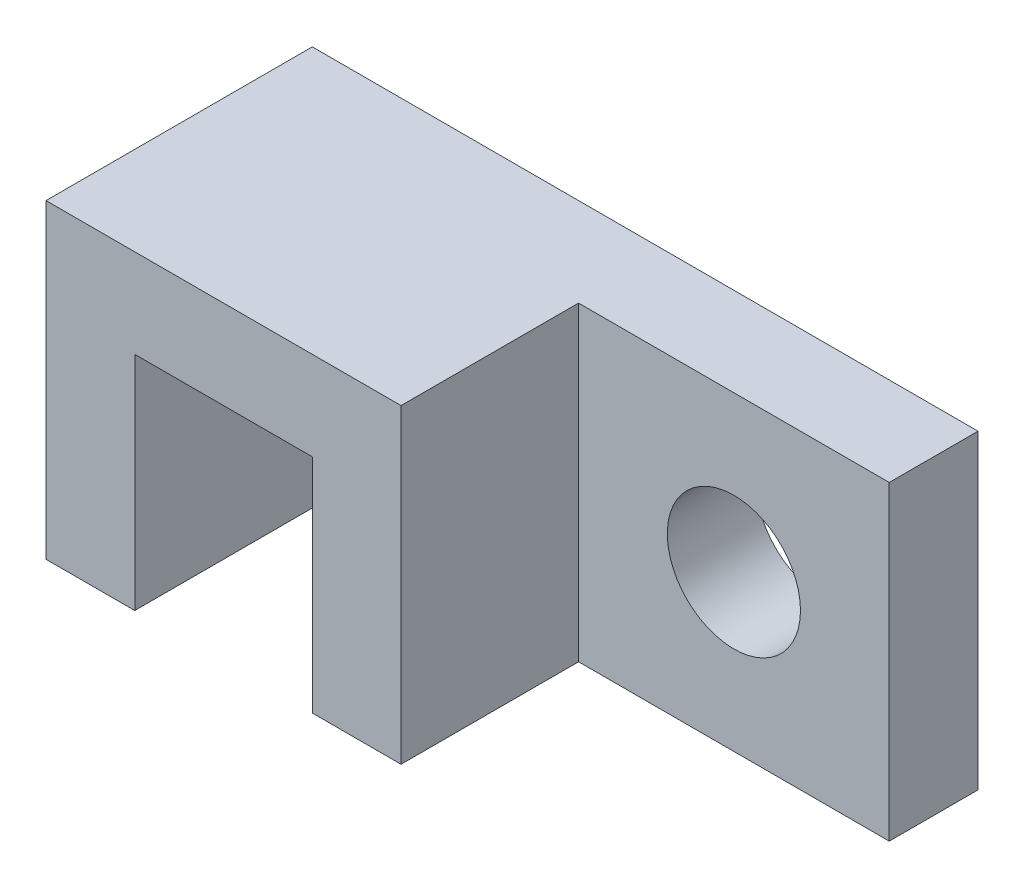
from build123d import *

# Parameters (mm, degrees)
BOSS_EXTRUDE1_DEPTH = 30
SKETCH1_3_W         = 35
SKETCH1_3_H         = 35
SKETCH1_3_R         = 7.5
BOSS_EXTRUDE2_DEPTH = 10


with BuildPart() as part:
    # Sketch1 → Boss-Extrude1 (new body)
    with BuildSketch(Plane.XY):
        Polygon((10, 0), (10, 25), (30, 25), (30, 0), (40, 0), (40, 35), (0, 35), (0, 0), align=None)
    extrude(amount=BOSS_EXTRUDE1_DEPTH)

    # Sketch1<3> → Boss-Extrude2 (add)
    with BuildSketch(Plane.XY):
        with Locations((57.5, 17.5)):
            Rectangle(SKETCH1_3_W, SKETCH1_3_H)
        with Locations((57.5, 17.5)):
            Circle(SKETCH1_3_R, mode=Mode.SUBTRACT)
    extrude(amount=BOSS_EXTRUDE2_DEPTH)


solid = part.part
